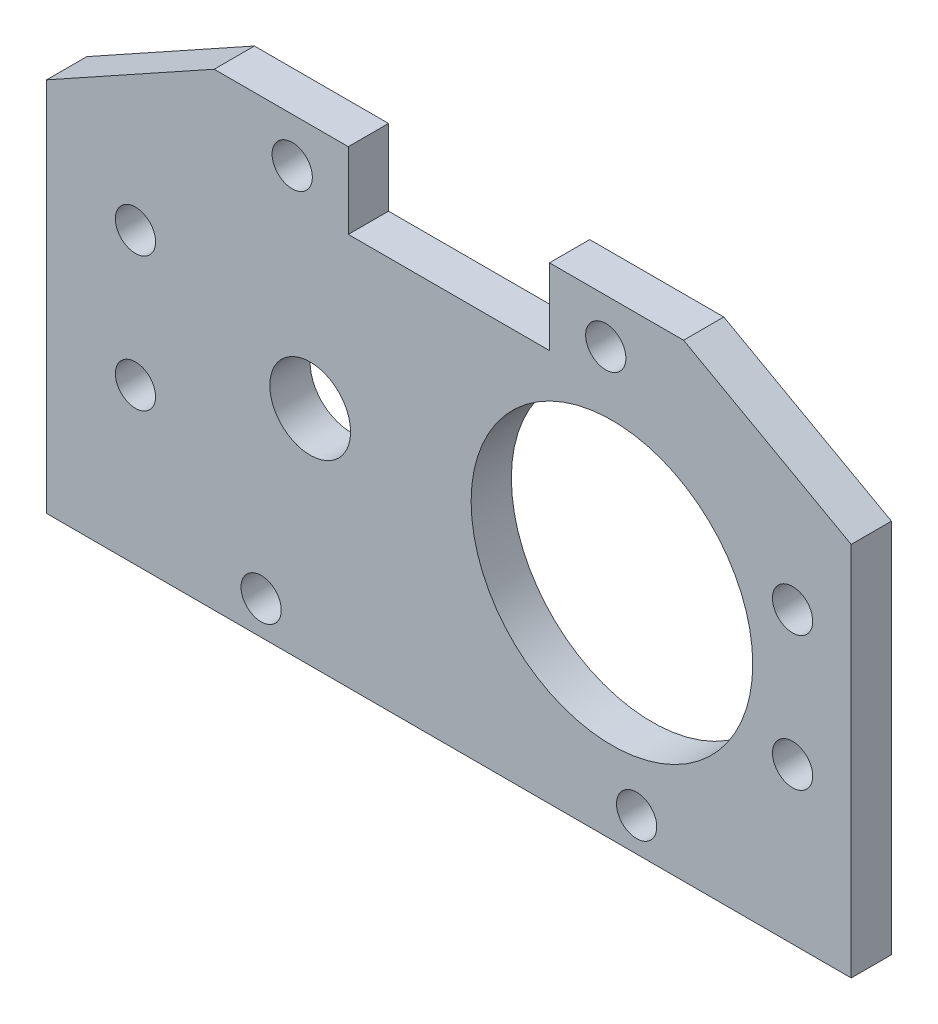
from build123d import *

# Parameters (mm, degrees)
EXTRUDE_1_DEPTH      = 3
SKETCH_2_R           = 1.5
CUT_EXTRUDE_7_DEPTH  = 43.02014847
SKETCH_4_R           = 1.5
CUT_EXTRUDE_8_DEPTH  = 43.02014847
SKETCH_6_R           = 10.5
SKETCH_6_R_2         = 3.01
CUT_EXTRUDE_9_DEPTH  = 43.02014847
SKETCH_7_R           = 1.5
CUT_EXTRUDE_10_DEPTH = 43.02014847


with BuildPart() as part:
    # 草图1 → 凸台-拉伸1 (new body)
    with BuildSketch(Plane.XY):
        Polygon((-7.5, 0), (7.5, 0), (7.5, 5.665837688), (17.5, 5.665837688), (30, -1.269316313), (30, -29.269316313), (-30, -29.269316313), (-30, -1.269316313), (-17.5, 5.665837688), (-7.5, 5.665837688), align=None)
    extrude(amount=EXTRUDE_1_DEPTH)

    # 草图2 → 切除-拉伸7 (cut, through all)
    with BuildSketch(Plane(origin=(0, 0, 0), x_dir=(-1, 0, 0), z_dir=(0, 0, -1))):
        with Locations((-25.62844718, -17.669380188)):
            Circle(SKETCH_2_R)
        with Locations((-25.62844718, -7.669380188)):
            Circle(SKETCH_2_R)
        with Locations((23.37155282, -17.669380188)):
            Circle(SKETCH_2_R)
        with Locations((23.37155282, -7.669380188)):
            Circle(SKETCH_2_R)
    extrude(amount=-CUT_EXTRUDE_7_DEPTH, mode=Mode.SUBTRACT)

    # 草图4 → 切除-拉伸8 (cut, through all)
    with BuildSketch(Plane(origin=(0, 0, 0), x_dir=(-1, 0, 0), z_dir=(0, 0, -1))):
        with Locations((-11.696832964, 2.350343297)):
            Circle(SKETCH_4_R)
        with Locations((11.682164636, 2.350343297)):
            Circle(SKETCH_4_R)
    extrude(amount=-CUT_EXTRUDE_8_DEPTH, mode=Mode.SUBTRACT)

    # 草图6 → 切除-拉伸9 (cut, through all)
    with BuildSketch(Plane(origin=(0, 0, 0), x_dir=(-1, 0, 0), z_dir=(0, 0, -1))):
        with Locations((-12.15844718, -12.669380188)):
            Circle(SKETCH_6_R)
        with Locations((10.34155282, -12.669316313)):
            Circle(SKETCH_6_R_2)
    extrude(amount=-CUT_EXTRUDE_9_DEPTH, mode=Mode.SUBTRACT)

    # 草图7 → 切除-拉伸10 (cut, through all)
    with BuildSketch(Plane(origin=(0, 0, 0), x_dir=(-1, 0, 0), z_dir=(0, 0, -1))):
        with Locations((14, -26.769316313)):
            Circle(SKETCH_7_R)
        with Locations((-14, -26.769316313)):
            Circle(SKETCH_7_R)
    extrude(amount=-CUT_EXTRUDE_10_DEPTH, mode=Mode.SUBTRACT)


solid = part.part
